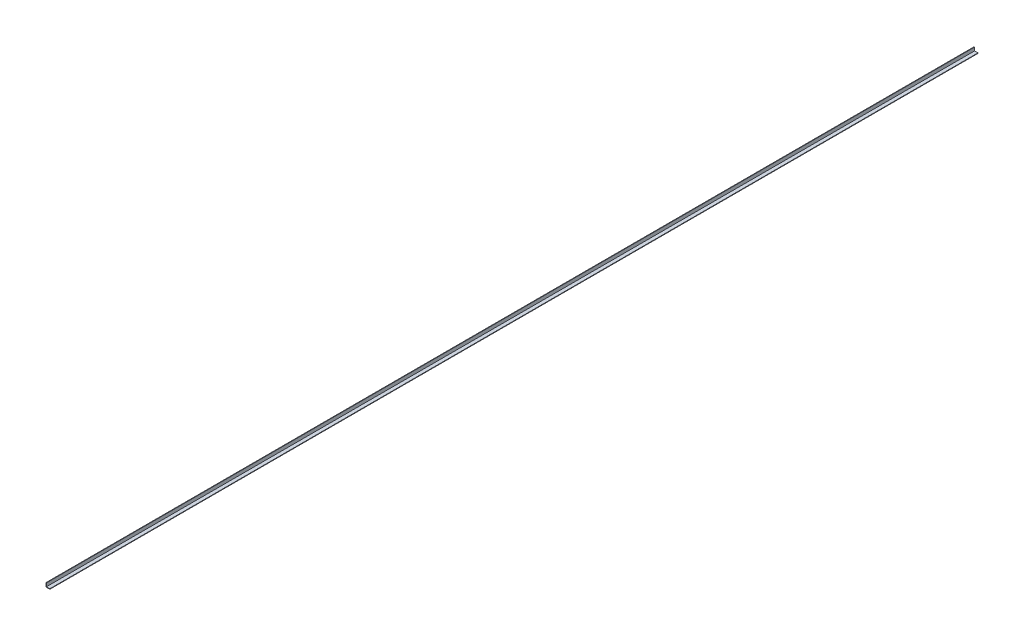
from build123d import *

# Parameters (mm, degrees)
SALIENTE_EXTRUIR1_DEPTH = 6100


with BuildPart() as part:
    # Croquis1 → Saliente-Extruir1 (new body)
    with BuildSketch(Plane.XY):
        Polygon((0, 25.4), (0, 0), (25.4, 0), (25.4, 3.18), (3.18, 3.18), (3.18, 25.4), align=None)
    extrude(amount=-SALIENTE_EXTRUIR1_DEPTH)


solid = part.part
